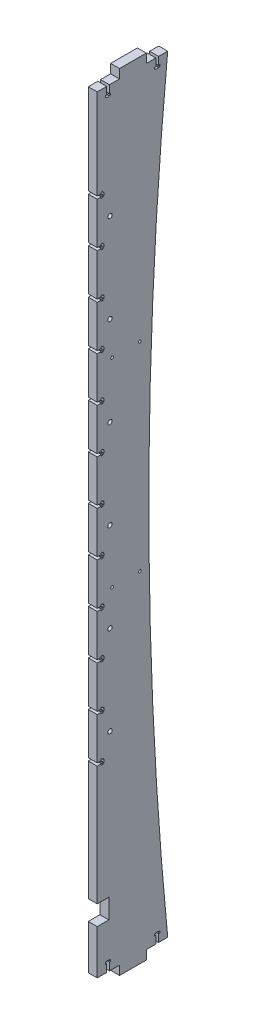
from build123d import *

# Parameters (mm, degrees)
DODANIE_WYCI_GNI_CIE1_DEPTH = 10
SZKIC1_W                    = 30
SZKIC1_H                    = 10.1
SZKIC1_W_2                  = 25
WYTNIJ_WYCI_GNI_CIE1_DEPTH  = 10
WYTNIJ_WYCI_GNI_CIE2_DEPTH  = 10
SZYK_LINIOWY1_COUNT         = 2
SZYK_LINIOWY1_PITCH         = 55
WYTNIJ_WYCI_GNI_CIE4_DEPTH  = 10
SZYK_LINIOWY2_COUNT         = 12
SZYK_LINIOWY2_PITCH         = 50
SZKIC14_R                   = 2.45
WYTNIJ_WYCI_GNI_CIE8_DEPTH  = 10
SZKIC8_W                    = 13
SZKIC8_H                    = 22
WYTNIJ_WYCI_GNI_CIE6_DEPTH  = 10
LUSTRO1_COPY_1_DEPTH        = 10
SZKIC13_R                   = 1.55
WYTNIJ_WYCI_GNI_CIE7_DEPTH  = 10
SZYK_LINIOWY4_COUNT         = 2
SZYK_LINIOWY4_PITCH         = 223
SZYK_LINIOWY5_COUNT         = 6
SZYK_LINIOWY5_PITCH         = 100


with BuildPart() as part:
    # Szkic11 → Dodanie-wyciągnięcie1 (new body)
    with BuildSketch(Plane.ZY.offset(-248.52281754)):
        with BuildLine():
            Line((-79.001367167, 0), (0, 0))
            Line((0, 0), (0, 880))
            Line((0, 880), (-78.955177412, 880))
            Line((-78.955177412, 880), (-78.955177412, 870))
            ThreePointArc((-78.955177412, 870), (-57.819766969, 439.998863597), (-79.001367167, 10))
            Line((-79.001367167, 10), (-79.001367167, 0))
        make_face()
    extrude(amount=DODANIE_WYCI_GNI_CIE1_DEPTH)

    # Szkic1 → Wytnij-wyciągnięcie1 (cut)
    with BuildSketch(Plane(origin=(248.52281754, 0, 0), x_dir=(0, 0, -1), z_dir=(1, 0, 0))):
        with Locations((70, 874.95)):
            Rectangle(SZKIC1_W, SZKIC1_H)
        with Locations((12.5, 874.95)):
            Rectangle(SZKIC1_W_2, SZKIC1_H)
    wytnij_wyci_gni_cie1 = extrude(amount=-WYTNIJ_WYCI_GNI_CIE1_DEPTH, mode=Mode.SUBTRACT)

    # Szkic2 → Wytnij-wyciągnięcie2 (cut)
    with BuildSketch(Plane(origin=(248.52281754, 0, 0), x_dir=(0, 0, -1), z_dir=(1, 0, 0))):
        Polygon((10.660920663, 869.9), (13.760920663, 869.9), (13.760920663, 861.4), (15.135920663, 861.4), (15.135920663, 859.4), (13.760920663, 859.4), (13.760920663, 858.9), (10.660920663, 858.9), (10.660920663, 859.4), (9.285920663, 859.4), (9.285920663, 861.4), (10.660920663, 861.4), align=None)
    wytnij_wyci_gni_cie2 = extrude(amount=-WYTNIJ_WYCI_GNI_CIE2_DEPTH, mode=Mode.SUBTRACT)

    # Szyk liniowy1: Wytnij-wyciągnięcie2 ×2
    with Locations(*[(0, 0, -i * SZYK_LINIOWY1_PITCH) for i in range(1, SZYK_LINIOWY1_COUNT)]):
        add(wytnij_wyci_gni_cie2, mode=Mode.SUBTRACT)

    # Szkic6 → Wytnij-wyciągnięcie4 (cut)
    with BuildSketch(Plane(origin=(248.52281754, 0, 0), x_dir=(0, 0, -1), z_dir=(1, 0, 0))):
        Polygon((0, 765.69), (4.5, 765.69), (4.5, 764.315), (6.5, 764.315), (6.5, 765.69), (7.5, 765.69), (7.5, 768.79), (6.5, 768.79), (6.5, 770.165), (4.5, 770.165), (4.5, 768.79), (0, 768.79), align=None)
    wytnij_wyci_gni_cie4 = extrude(amount=-WYTNIJ_WYCI_GNI_CIE4_DEPTH, mode=Mode.SUBTRACT)

    # Szyk liniowy2: Wytnij-wyciągnięcie4 ×12
    with Locations(*[(0, -i * SZYK_LINIOWY2_PITCH, 0) for i in range(1, SZYK_LINIOWY2_COUNT)]):
        add(wytnij_wyci_gni_cie4, mode=Mode.SUBTRACT)

    # Szkic14 → Wytnij-wyciągnięcie8 (cut)
    with BuildSketch(Plane.ZY.offset(-238.52281754)):
        with Locations((-14.31069395, 742.236985413)):
            Circle(SZKIC14_R)
    wytnij_wyci_gni_cie8 = extrude(amount=-WYTNIJ_WYCI_GNI_CIE8_DEPTH, mode=Mode.SUBTRACT)

    # Szkic8 → Wytnij-wyciągnięcie6 (cut)
    with BuildSketch(Plane(origin=(248.52281754, 0, 0), x_dir=(0, 0, -1), z_dir=(1, 0, 0))):
        with Locations((6.5, 71)):
            Rectangle(SZKIC8_W, SZKIC8_H)
    extrude(amount=-WYTNIJ_WYCI_GNI_CIE6_DEPTH, mode=Mode.SUBTRACT)

    # Lustro1: Wytnij-wyciągnięcie1, Wytnij-wyciągnięcie2 across plane
    add(wytnij_wyci_gni_cie1.mirror(Plane.ZX.offset(440)), mode=Mode.SUBTRACT)
    add(wytnij_wyci_gni_cie2.mirror(Plane.ZX.offset(440)), mode=Mode.SUBTRACT)

    # Lustro1 copy 1 sketch → Lustro1 copy 1 (cut)
    with BuildSketch(Plane(origin=(248.52281754, 880, -55), x_dir=(0, 0, -1), z_dir=(1, 0, 0))):
        Polygon((10.660920663, -869.9), (13.760920663, -869.9), (13.760920663, -861.4), (15.135920663, -861.4), (15.135920663, -859.4), (13.760920663, -859.4), (13.760920663, -858.9), (10.660920663, -858.9), (10.660920663, -859.4), (9.285920663, -859.4), (9.285920663, -861.4), (10.660920663, -861.4), align=None)
    extrude(amount=-LUSTRO1_COPY_1_DEPTH, mode=Mode.SUBTRACT)

    # Szkic13 → Wytnij-wyciągnięcie7 (cut)
    with BuildSketch(Plane(origin=(248.52281754, 0, 0), x_dir=(0, 0, -1), z_dir=(1, 0, 0))):
        with Locations((16.7, 380.736985413)):
            Circle(SZKIC13_R)
        with Locations((47.7, 380.736985413)):
            Circle(SZKIC13_R)
    wytnij_wyci_gni_cie7 = extrude(amount=-WYTNIJ_WYCI_GNI_CIE7_DEPTH, mode=Mode.SUBTRACT)

    # Szyk liniowy4: Wytnij-wyciągnięcie7 ×2
    with Locations(*[(0, i * SZYK_LINIOWY4_PITCH, 0) for i in range(1, SZYK_LINIOWY4_COUNT)]):
        add(wytnij_wyci_gni_cie7, mode=Mode.SUBTRACT)

    # Szyk liniowy5: Wytnij-wyciągnięcie8 ×6
    with Locations(*[(0, -i * SZYK_LINIOWY5_PITCH, 0) for i in range(1, SZYK_LINIOWY5_COUNT)]):
        add(wytnij_wyci_gni_cie8, mode=Mode.SUBTRACT)


solid = part.part
